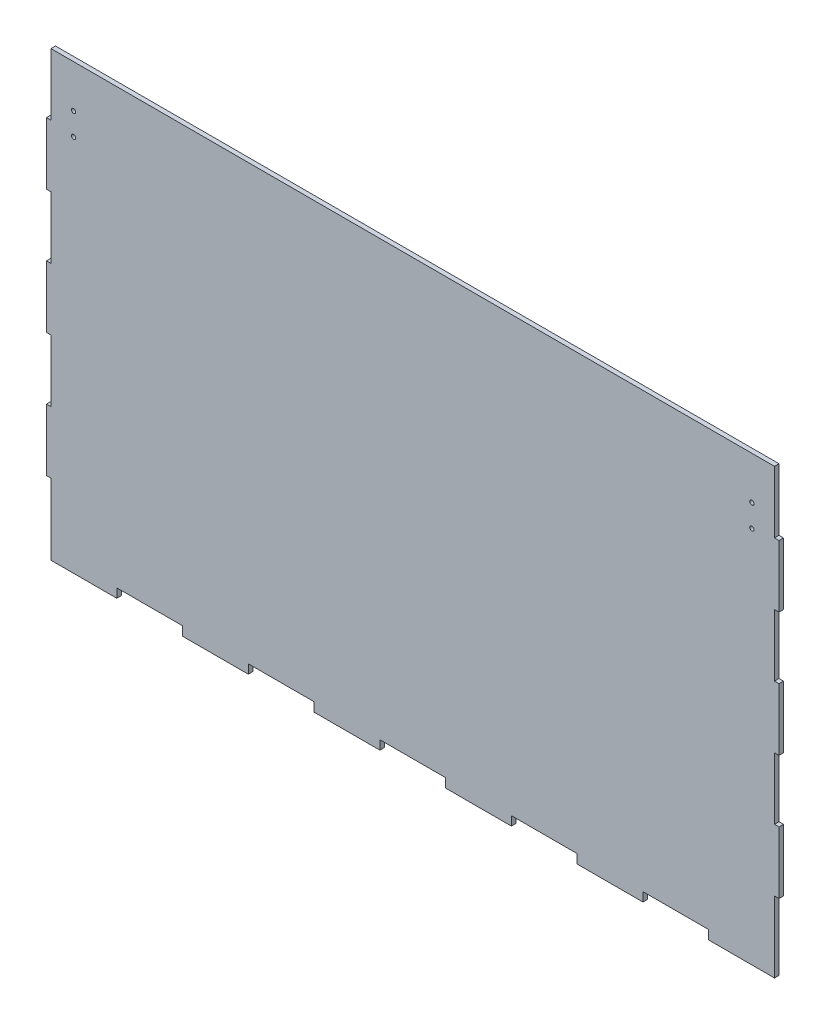
from build123d import *

# Parameters (mm, degrees)
SKETCH1_W           = 508
SKETCH1_H           = 304.8
SKETCH1_W_2         = 46.181818182
SKETCH1_H_2         = 6.35
SKETCH1_W_3         = 46.181818181
SKETCH1_W_4         = 3.175
SKETCH1_H_3         = 43.542857143
SKETCH1_H_4         = 43.542857142
BOSS_EXTRUDE1_DEPTH = 3.175
SKETCH2_R           = 1.5
CUT_EXTRUDE1_DEPTH  = 3.175


with BuildPart() as part:
    # Sketch1 → Boss-Extrude1 (new body)
    with BuildSketch(Plane.XY):
        with Locations((254, 152.4)):
            Rectangle(SKETCH1_W, SKETCH1_H)
        with Locations((23.090909091, -3.175)):
            Rectangle(SKETCH1_W_2, SKETCH1_H_2)
        with Locations((115.454545455, -3.175)):
            Rectangle(SKETCH1_W_3, SKETCH1_H_2)
        with Locations((207.818181818, -3.175)):
            Rectangle(SKETCH1_W_2, SKETCH1_H_2)
        with Locations((300.181818182, -3.175)):
            Rectangle(SKETCH1_W_2, SKETCH1_H_2)
        with Locations((392.545454545, -3.175)):
            Rectangle(SKETCH1_W_3, SKETCH1_H_2)
        with Locations((484.909090909, -3.175)):
            Rectangle(SKETCH1_W_2, SKETCH1_H_2)
        with Locations((509.5875, 65.314285715)):
            Rectangle(SKETCH1_W_4, SKETCH1_H_3)
        with Locations((509.5875, 152.4)):
            Rectangle(SKETCH1_W_4, SKETCH1_H_4)
        with Locations((509.5875, 239.485714286)):
            Rectangle(SKETCH1_W_4, SKETCH1_H_3)
        with Locations((-1.5875, 239.485714286)):
            Rectangle(SKETCH1_W_4, SKETCH1_H_3)
        with Locations((-1.5875, 152.4)):
            Rectangle(SKETCH1_W_4, SKETCH1_H_4)
        with Locations((-1.5875, 65.314285715)):
            Rectangle(SKETCH1_W_4, SKETCH1_H_3)
    extrude(amount=BOSS_EXTRUDE1_DEPTH)

    # Sketch2 → Cut-Extrude1 (cut)
    with BuildSketch(Plane.XY.offset(3.175)):
        with Locations((15.875, 274.8)):
            Circle(SKETCH2_R)
        with Locations((15.875, 259.05)):
            Circle(SKETCH2_R)
        with Locations((492.125, 259.05)):
            Circle(SKETCH2_R)
        with Locations((492.125, 274.8)):
            Circle(SKETCH2_R)
    extrude(amount=-CUT_EXTRUDE1_DEPTH, mode=Mode.SUBTRACT)


solid = part.part
